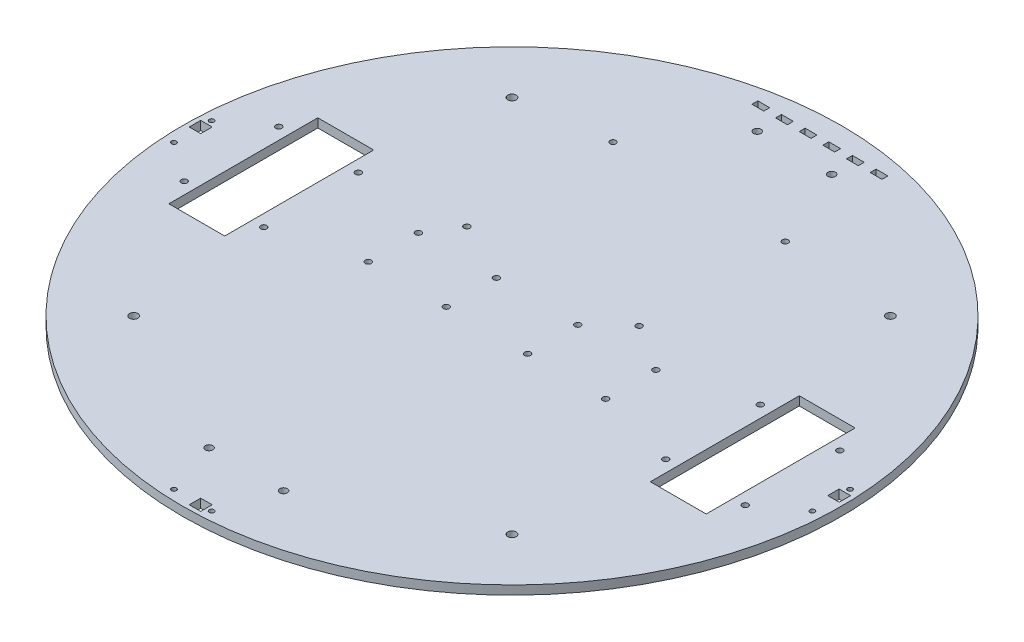
from build123d import *

# Parameters (mm, degrees)
SKETCH1_R           = 177
SKETCH1_R_2         = 1.6
SKETCH1_R_3         = 2.2479
SKETCH1_R_4         = 2.000000064
SKETCH1_R_5         = 1.3
SKETCH1_R_6         = 1.29999994
SKETCH1_W           = 6.15
SKETCH1_H           = 6.15
SKETCH1_W_2         = 30
SKETCH1_H_2         = 80
SKETCH1_W_3         = 6.35
SKETCH1_H_3         = 3.175
BOSS_EXTRUDE1_DEPTH = 4.7625


with BuildPart() as part:
    # Sketch1 → Boss-Extrude1 (new body)
    with BuildSketch(Plane(origin=(0, 0, 0), x_dir=(1, 0, 0), z_dir=(0, 1, 0))):
        with Locations(Location((0, 0, 0), (0, 0, 90))):
            Circle(SKETCH1_R)
        with Locations(Location((-150.65, 25.4, 0), (0, 0, 90))):
            Circle(SKETCH1_R_2, mode=Mode.SUBTRACT)
        with Locations(Location((-150.65, -25.4, 0), (0, 0, 90))):
            Circle(SKETCH1_R_2, mode=Mode.SUBTRACT)
        with Locations(Location((150.65, 25.4, 0), (0, 0, 90))):
            Circle(SKETCH1_R_2, mode=Mode.SUBTRACT)
        with Locations(Location((150.65, -25.4, 0), (0, 0, 90))):
            Circle(SKETCH1_R_2, mode=Mode.SUBTRACT)
        with Locations(Location((-107.95, 25.4, 0), (0, 0, 90))):
            Circle(SKETCH1_R_2, mode=Mode.SUBTRACT)
        with Locations(Location((-107.95, -25.4, 0), (0, 0, 90))):
            Circle(SKETCH1_R_2, mode=Mode.SUBTRACT)
        with Locations(Location((107.95, 25.4, 0), (0, 0, 90))):
            Circle(SKETCH1_R_2, mode=Mode.SUBTRACT)
        with Locations(Location((107.95, -25.4, 0), (0, 0, 90))):
            Circle(SKETCH1_R_2, mode=Mode.SUBTRACT)
        with Locations(Location((-53.7, 107.95, 0), (0, 0, 90))):
            Circle(SKETCH1_R_2, mode=Mode.SUBTRACT)
        with Locations(Location((38.8, 107.95, 0), (0, 0, 90))):
            Circle(SKETCH1_R_2, mode=Mode.SUBTRACT)
        with Locations(Location((-53.7, 29.45, 0), (0, 0, 90))):
            Circle(SKETCH1_R_2, mode=Mode.SUBTRACT)
        with Locations(Location((38.8, 29.45, 0), (0, 0, 90))):
            Circle(SKETCH1_R_2, mode=Mode.SUBTRACT)
        with Locations(Location((-101.6, -101.6, 0), (0, 0, 90))):
            Circle(SKETCH1_R_3, mode=Mode.SUBTRACT)
        with Locations(Location((101.6, -101.6, 0), (0, 0, 90))):
            Circle(SKETCH1_R_3, mode=Mode.SUBTRACT)
        with Locations(Location((-101.6, 101.6, 0), (0, 0, 90))):
            Circle(SKETCH1_R_3, mode=Mode.SUBTRACT)
        with Locations(Location((101.6, 101.6, 0), (0, 0, 90))):
            Circle(SKETCH1_R_3, mode=Mode.SUBTRACT)
        with Locations(Location((-20, -142.687006289, 0), (0, 0, 90))):
            Circle(SKETCH1_R_4, mode=Mode.SUBTRACT)
        with Locations(Location((20, -142.687006289, 0), (0, 0, 90))):
            Circle(SKETCH1_R_4, mode=Mode.SUBTRACT)
        with Locations(Location((-20, 151.719279026, 0), (0, 0, 90))):
            Circle(SKETCH1_R_4, mode=Mode.SUBTRACT)
        with Locations(Location((20, 151.719279026, 0), (0, 0, 90))):
            Circle(SKETCH1_R_4, mode=Mode.SUBTRACT)
        with Locations(Location((-10.125, -171.45, 0), (0, 0, 90))):
            Circle(SKETCH1_R_5, mode=Mode.SUBTRACT)
        with Locations(Location((10.125, -171.45, 0), (0, 0, 90))):
            Circle(SKETCH1_R_6, mode=Mode.SUBTRACT)
        with Locations(Location((171.45, -10.125, 0), (0, 0, 90))):
            Circle(SKETCH1_R_5, mode=Mode.SUBTRACT)
        with Locations(Location((171.45, 10.125, 0), (0, 0, 90))):
            Circle(SKETCH1_R_5, mode=Mode.SUBTRACT)
        with Locations(Location((-171.45, -10.125, 0), (0, 0, 90))):
            Circle(SKETCH1_R_5, mode=Mode.SUBTRACT)
        with Locations(Location((-171.45, 10.125, 0), (0, 0, 90))):
            Circle(SKETCH1_R_5, mode=Mode.SUBTRACT)
        with Locations(Location((-63.76, 13.473999986, 0), (0, 0, 90))):
            Circle(SKETCH1_R_2, mode=Mode.SUBTRACT)
        with Locations(Location((-63.76, -13.450000014, 0), (0, 0, 90))):
            Circle(SKETCH1_R_2, mode=Mode.SUBTRACT)
        with Locations(Location((-21.85, 13.473999986, 0), (0, 0, 90))):
            Circle(SKETCH1_R_2, mode=Mode.SUBTRACT)
        with Locations(Location((-21.85, -13.450000014, 0), (0, 0, 90))):
            Circle(SKETCH1_R_2, mode=Mode.SUBTRACT)
        with Locations(Location((63.76, -13.450000014, 0), (0, 0, 90))):
            Circle(SKETCH1_R_2, mode=Mode.SUBTRACT)
        with Locations(Location((21.85, -13.450000014, 0), (0, 0, 90))):
            Circle(SKETCH1_R_2, mode=Mode.SUBTRACT)
        with Locations(Location((21.85, 13.473999986, 0), (0, 0, 90))):
            Circle(SKETCH1_R_2, mode=Mode.SUBTRACT)
        with Locations(Location((63.76, 13.473999986, 0), (0, 0, 90))):
            Circle(SKETCH1_R_2, mode=Mode.SUBTRACT)
        with Locations((171.45, 4.26)):
            Rectangle(SKETCH1_W, SKETCH1_H, mode=Mode.SUBTRACT)
        with Locations((-129.3, 0)):
            Rectangle(SKETCH1_W_2, SKETCH1_H_2, mode=Mode.SUBTRACT)
        with Locations((129.3, 0)):
            Rectangle(SKETCH1_W_2, SKETCH1_H_2, mode=Mode.SUBTRACT)
        with Locations((4.26, -171.45)):
            Rectangle(SKETCH1_W, SKETCH1_H, mode=Mode.SUBTRACT)
        with Locations((-171.45, 4.26)):
            Rectangle(SKETCH1_W, SKETCH1_H, mode=Mode.SUBTRACT)
        with Locations((-18.119952608, 164.452014647)):
            Rectangle(SKETCH1_W_3, SKETCH1_H_3, mode=Mode.SUBTRACT)
        with Locations((-30.819952608, 164.452014647)):
            Rectangle(SKETCH1_W_3, SKETCH1_H_3, mode=Mode.SUBTRACT)
        with Locations((-5.419952608, 164.452014647)):
            Rectangle(SKETCH1_W_3, SKETCH1_H_3, mode=Mode.SUBTRACT)
        with Locations((7.280047392, 164.452014647)):
            Rectangle(SKETCH1_W_3, SKETCH1_H_3, mode=Mode.SUBTRACT)
        with Locations((19.980047392, 164.452014647)):
            Rectangle(SKETCH1_W_3, SKETCH1_H_3, mode=Mode.SUBTRACT)
        with Locations((32.680047392, 164.452014647)):
            Rectangle(SKETCH1_W_3, SKETCH1_H_3, mode=Mode.SUBTRACT)
    extrude(amount=BOSS_EXTRUDE1_DEPTH)


solid = part.part
